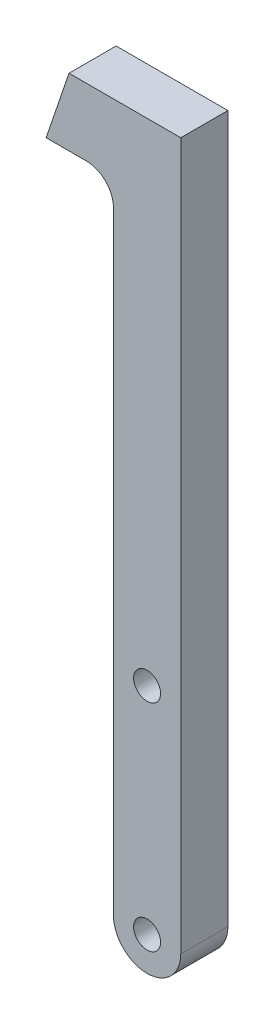
from build123d import *

# Parameters (mm, degrees)
BOSS_EXTRU_1_DEPTH      = 3.5
ESQUISSE3_R             = 1
ENL_V_MAT_EXTRU_1_DEPTH = 4
ESQUISSE4_R             = 1
ENL_V_MAT_EXTRU_2_DEPTH = 10
ENL_V_MAT_EXTRU_3_DEPTH = 57.011159602
CONG_1_R                = 2


with BuildPart() as part:
    # Esquisse1 → Boss.-Extru.1 (new body)
    with BuildSketch(Plane.XY):
        with BuildLine():
            Line((0, 0), (10, 0))
            Line((10, 0), (10, -52.5))
            ThreePointArc((10, -52.5), (7.5, -55), (5, -52.5))
            Line((5, -52.5), (5, -5))
            Line((5, -5), (0, -5))
            Line((0, -5), (0, 0))
        make_face()
    extrude(amount=BOSS_EXTRU_1_DEPTH)

    # Esquisse3 → Enlèv. mat.-Extru.1 (cut)
    with BuildSketch(Plane(origin=(0, 0, 0), x_dir=(-1, 0, 0), z_dir=(0, 0, -1))):
        with Locations((-7.5, -52.5)):
            Circle(ESQUISSE3_R)
    extrude(amount=-ENL_V_MAT_EXTRU_1_DEPTH, mode=Mode.SUBTRACT)

    # Esquisse4 → Enlèv. mat.-Extru.2 (cut)
    with BuildSketch(Plane.XY.offset(3.5)):
        with Locations((7.5, -36.5)):
            Circle(ESQUISSE4_R)
    extrude(amount=-ENL_V_MAT_EXTRU_2_DEPTH, mode=Mode.SUBTRACT)

    # Esquisse5 → Enlèv. mat.-Extru.3 (cut, through all)
    with BuildSketch(Plane.XY.offset(3.5)):
        Polygon((0, 0), (1.700931961, 0), (0, -5), align=None)
    extrude(amount=-ENL_V_MAT_EXTRU_3_DEPTH, mode=Mode.SUBTRACT)

    # Congé1
    cong_1_edges = [part.edges().sort_by_distance(p)[0] for p in [
        (5, -5, 1.75),
    ]]
    fillet(cong_1_edges, radius=CONG_1_R)


solid = part.part
